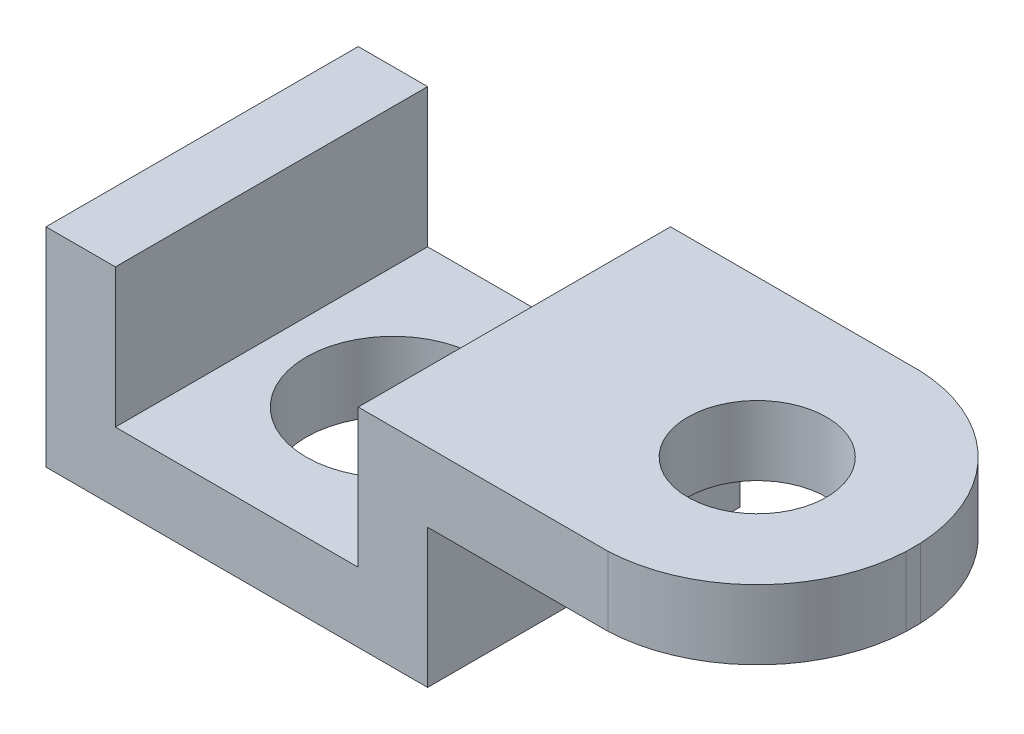
from build123d import *

# Parameters (mm, degrees)
BOSS_EXTRUDE1_DEPTH = 28.575
SKETCH3_R           = 15.875
CUT_EXTRUDE1_DEPTH  = 12.7
SKETCH4_R           = 12.7
CUT_EXTRUDE2_DEPTH  = 12.7


with BuildPart() as part:
    # Sketch2 → Boss-Extrude1 (new, symmetric)
    with BuildSketch(Plane.XY):
        Polygon((0, 0), (69.85, 0), (69.85, 25.4), (130.175, 25.4), (130.175, 38.1), (57.15, 38.1), (57.15, 12.7), (12.7, 12.7), (12.7, 38.1), (0, 38.1), align=None)
    extrude(amount=BOSS_EXTRUDE1_DEPTH, both=True)

    # Sketch3 → Cut-Extrude1 (cut)
    with BuildSketch(Plane(origin=(0, 12.7, 0), x_dir=(1, 0, 0), z_dir=(0, 1, 0))):
        with Locations(Location((34.925, 0, 0), (0, 0, 180))):
            Circle(SKETCH3_R)
    extrude(amount=-CUT_EXTRUDE1_DEPTH, mode=Mode.SUBTRACT)

    # Sketch4 → Cut-Extrude2 (cut)
    with BuildSketch(Plane(origin=(0, 38.1, 0), x_dir=(1, 0, 0), z_dir=(0, 1, 0))):
        with Locations(Location((101.6, 0, 0), (0, 0, 180))):
            Circle(SKETCH4_R)
        with BuildLine():
            Line((130.175, 28.575), (102.896747677, 28.575))
            ThreePointArc((102.896747677, 28.575), (121.826371147, 20.226371147), (130.175, 1.296747677))
            Line((130.175, 1.296747677), (130.175, 28.575))
        make_face()
        with BuildLine():
            Line((130.175, -28.575), (130.175, -1.296747677))
            ThreePointArc((130.175, -1.296747677), (121.826371147, -20.226371147), (102.896747677, -28.575))
            Line((102.896747677, -28.575), (130.175, -28.575))
        make_face()
    extrude(amount=-CUT_EXTRUDE2_DEPTH, mode=Mode.SUBTRACT)


solid = part.part
